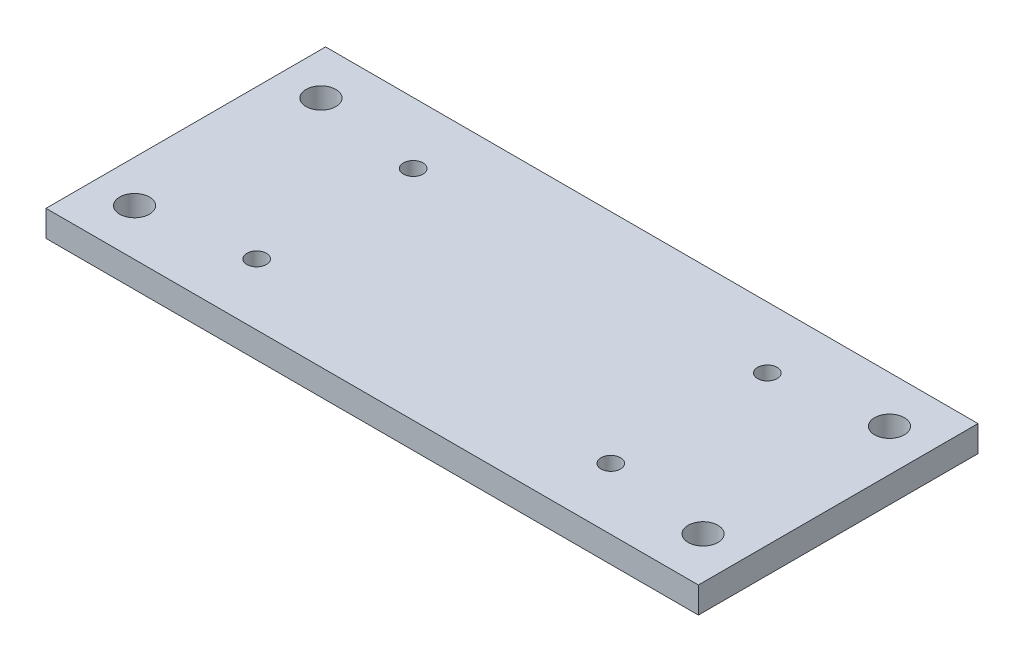
from build123d import *

# Parameters (mm, degrees)
SKETCH1_W           = 175
SKETCH1_H           = 75
BOSS_EXTRUDE1_DEPTH = 7
SKETCH2_R           = 4
SKETCH2_R_2         = 2.625
CUT_EXTRUDE1_DEPTH  = 191.522964495


with BuildPart() as part:
    # Sketch1 → Boss-Extrude1 (new body)
    with BuildSketch(Plane(origin=(0, 0, 0), x_dir=(1, 0, 0), z_dir=(0, 1, 0))):
        with Locations((87.5, 37.5)):
            Rectangle(SKETCH1_W, SKETCH1_H)
    extrude(amount=BOSS_EXTRUDE1_DEPTH)

    # Sketch2 → Cut-Extrude1 (cut, through all)
    with BuildSketch(Plane(origin=(0, 7, 0), x_dir=(1, 0, 0), z_dir=(0, 1, 0))):
        with Locations(Location((11.25, 62.5, 0), (0, 0, 270))):
            Circle(SKETCH2_R)
        with Locations(Location((11.25, 12.5, 0), (0, 0, 270))):
            Circle(SKETCH2_R)
        with Locations(Location((163.75, 12.5, 0), (0, 0, 90))):
            Circle(SKETCH2_R)
        with Locations(Location((163.75, 62.5, 0), (0, 0, 90))):
            Circle(SKETCH2_R)
        with Locations(Location((40, 58.5, 0), (0, 0, 270))):
            Circle(SKETCH2_R_2)
        with Locations(Location((40, 16.5, 0), (0, 0, 270))):
            Circle(SKETCH2_R_2)
        with Locations(Location((135, 16.5, 0), (0, 0, 90))):
            Circle(SKETCH2_R_2)
        with Locations(Location((135, 58.5, 0), (0, 0, 90))):
            Circle(SKETCH2_R_2)
    extrude(amount=-CUT_EXTRUDE1_DEPTH, mode=Mode.SUBTRACT)


solid = part.part
